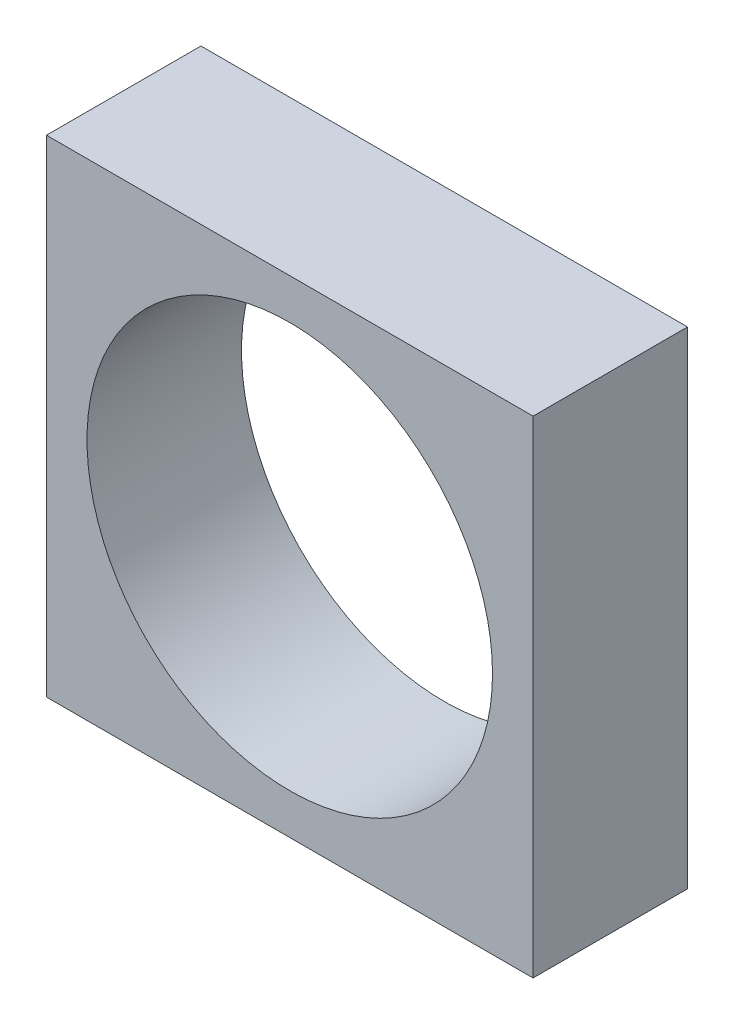
from build123d import *

# Parameters (mm, degrees)
SKETCH1_W           = 60
SKETCH1_H           = 60
BOSS_EXTRUDE1_DEPTH = 19.05
SKETCH2_R           = 25
CUT_EXTRUDE1_DEPTH  = 87.964949836


with BuildPart() as part:
    # Sketch1 → Boss-Extrude1 (new body)
    with BuildSketch(Plane.XY):
        with Locations((30, 30)):
            Rectangle(SKETCH1_W, SKETCH1_H)
    extrude(amount=BOSS_EXTRUDE1_DEPTH)

    # Sketch2 → Cut-Extrude1 (cut, through all)
    with BuildSketch(Plane.XY.offset(19.05)):
        with Locations((30, 30)):
            Circle(SKETCH2_R)
    extrude(amount=-CUT_EXTRUDE1_DEPTH, mode=Mode.SUBTRACT)


solid = part.part
